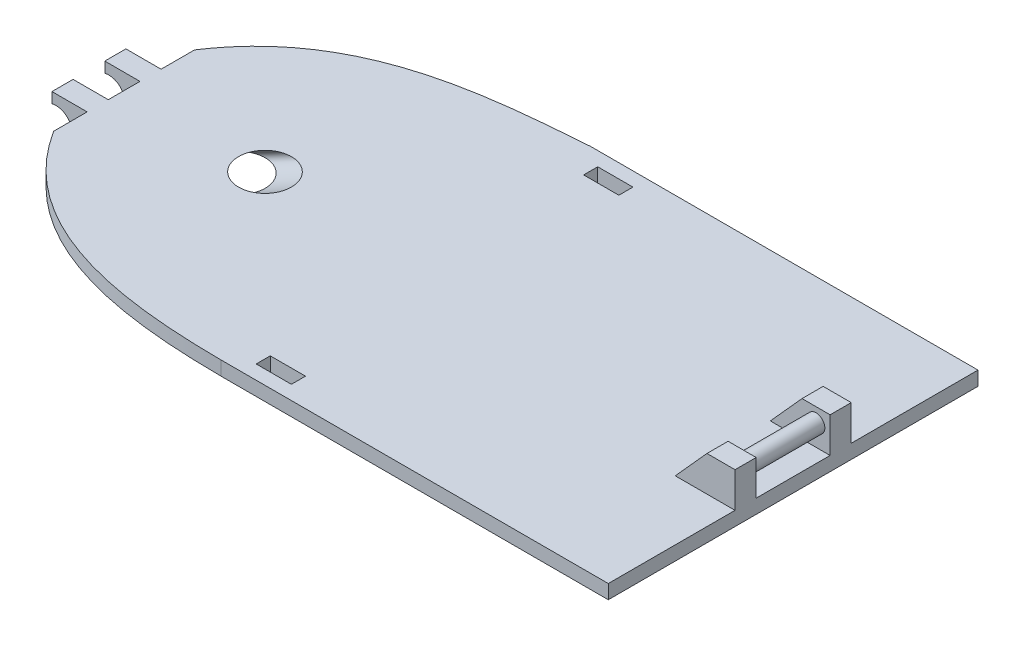
from build123d import *

# Parameters (mm, degrees)
BOSS_EXTRUDE1_DEPTH = 4
BOSS_EXTRUDE2_START = -45
BOSS_EXTRUDE2_DEPTH = 3
BOSS_EXTRUDE3_START = -39
BOSS_EXTRUDE3_DEPTH = 3
BOSS_EXTRUDE4_REACH = 212.155
SKETCH6_R           = 2.5
SKETCH7_W           = 10
SKETCH7_H           = 4
CUT_EXTRUDE1_DEPTH  = 10
SKETCH8_R           = 7.5


with BuildPart() as part:
    # Sketch1 → Boss-Extrude1 (new body)
    with BuildSketch(Plane(origin=(0, 0, 0), x_dir=(1, 0, 0), z_dir=(0, 1, 0))):
        with BuildLine():
            Line((-110, 0), (0, 0))
            Line((0, 0), (0, -105))
            Line((0, -105), (-110, -105))
            add(Edge.make_bspline(
                [(-190, -72.5), (-172.262756658, -100.700379519), (-139.265999107, -104.836107107), (-110, -105)],
                knots=[0, 0, 0, 0, 1, 1, 1, 1], degree=3))
            Line((-190, -72.5), (-190, -32.5))
            add(Edge.make_bspline(
                [(-190, -32.5), (-171.707374586, -4.618888995), (-138.989901699, -2.178666842), (-110, 0)],
                knots=[0, 0, 0, 0, 1, 1, 1, 1], degree=3))
        make_face()
    extrude(amount=BOSS_EXTRUDE1_DEPTH)

    # Sketch2 → Boss-Extrude2 (add, symmetric)
    with BuildSketch(Plane.XY.offset(105).offset(BOSS_EXTRUDE2_START)):
        with BuildLine():
            Line((-190, 4), (-200, 4))
            Line((-200, 4), (-200, 1))
            ThreePointArc((-200, 1), (-194.2, -3.5), (-200, -8))
            Line((-200, -8), (-200, -11))
            Line((-200, -11), (-190, -11))
            Line((-190, -11), (-178, 0))
            Line((-178, 0), (-190, 4))
        make_face()
    boss_extrude2 = extrude(amount=BOSS_EXTRUDE2_DEPTH, both=True)

    # Mirror1: Boss-Extrude2 across plane
    add(boss_extrude2.mirror(Plane.XY.offset(52.5)))

    # Sketch5 → Boss-Extrude3 (add, symmetric)
    with BuildSketch(Plane.XY.offset(105).offset(BOSS_EXTRUDE3_START)):
        Polygon((-16.979807258, 4), (-7.979807258, 14), (0, 14), (0, 4), align=None)
    boss_extrude3 = extrude(amount=BOSS_EXTRUDE3_DEPTH, both=True)

    # Mirror4: Boss-Extrude3 across plane
    add(boss_extrude3.mirror(Plane.XY.offset(52.5)))

    # Sketch6 → Boss-Extrude4 (add, up to next)
    with BuildSketch(Plane.XY.offset(42), mode=Mode.PRIVATE) as boss_extrude4_sk1:
        with Locations(Location((-4, 10, 0), (0, 0, 180))):
            Circle(SKETCH6_R)
    boss_extrude4_tool1 = extrude(boss_extrude4_sk1.sketch, amount=BOSS_EXTRUDE4_REACH, mode=Mode.PRIVATE) - part.part
    add(boss_extrude4_tool1.solids().sort_by_distance((-4, 10, 42))[0])

    # Sketch7 → Cut-Extrude1 (cut)
    with BuildSketch(Plane(origin=(0, 4, 0), x_dir=(1, 0, 0), z_dir=(0, 1, 0))):
        with Locations((-99, -99)):
            Rectangle(SKETCH7_W, SKETCH7_H)
    cut_extrude1 = extrude(amount=-CUT_EXTRUDE1_DEPTH, mode=Mode.SUBTRACT)

    # Mirror5: Cut-Extrude1 across plane
    add(cut_extrude1.mirror(Plane.XY.offset(52.5)), mode=Mode.SUBTRACT)

    # Cut-Sweep1: sweep along a path in Sketch9
    with BuildLine(Plane.XY.offset(52.5)) as cut_sweep1_path:
        Line((-150, 4), (-163.867437875, -3.466183031))
    # Sketch8 → Cut-Sweep1 (sweep, cut)
    with BuildSketch(Plane(origin=(0, 4, 0), x_dir=(1, 0, 0), z_dir=(0, 1, 0))):
        with Locations((-150, -52.5)):
            Circle(SKETCH8_R)
    sweep(path=cut_sweep1_path.line, mode=Mode.SUBTRACT)


solid = part.part
